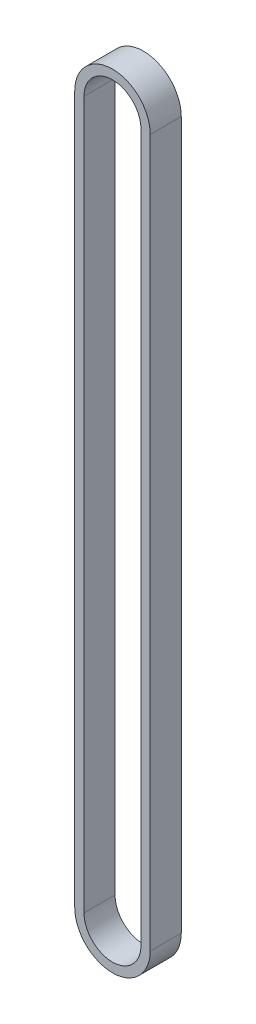
from build123d import *

# Parameters (mm, degrees)
EXTRUDE_1_DEPTH = 10


with BuildPart() as part:
    # 草图1 → 凸台-拉伸1 (new body)
    with BuildSketch(Plane.XY):
        with BuildLine():
            Line((-12.17, -114), (-12.17, 114))
            ThreePointArc((-12.17, 114), (0, 126.17), (12.17, 114))
            Line((12.17, 114), (12.17, -114))
            ThreePointArc((12.17, -114), (0, -126.17), (-12.17, -114))
        make_face()
        with BuildLine():
            Line((-9.17, -114), (-9.17, 114))
            ThreePointArc((-9.17, 114), (0, 123.17), (9.17, 114))
            Line((9.17, 114), (9.17, -114))
            ThreePointArc((9.17, -114), (0, -123.17), (-9.17, -114))
        make_face(mode=Mode.SUBTRACT)
    extrude(amount=EXTRUDE_1_DEPTH)


solid = part.part
